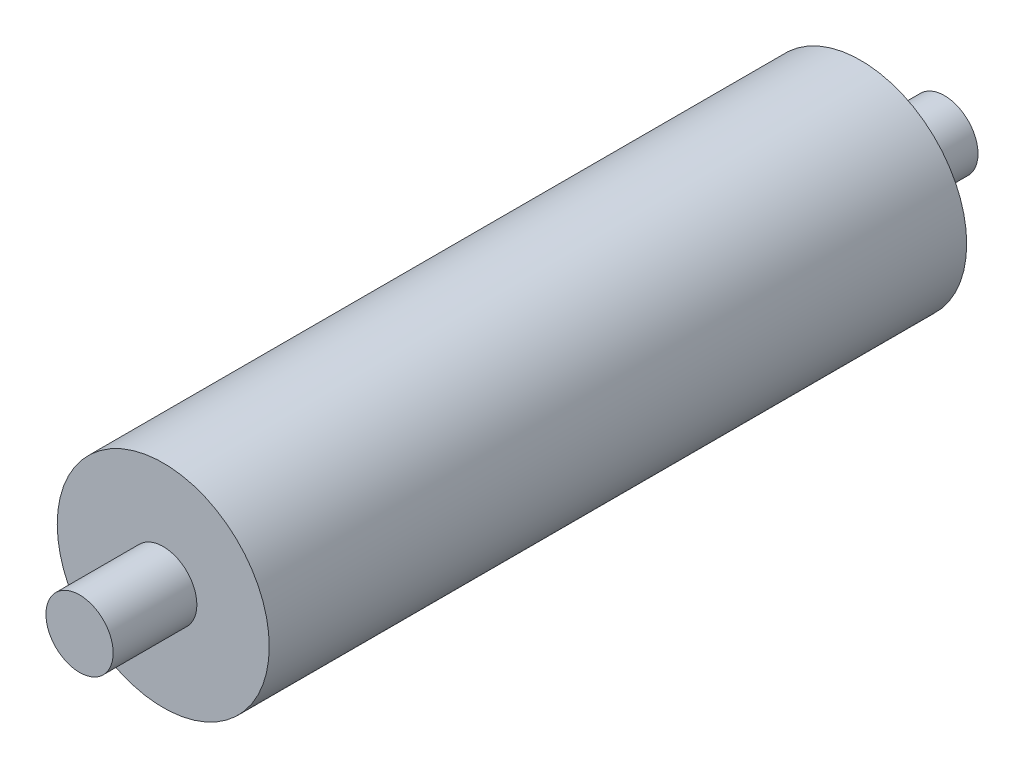
from build123d import *

# Parameters (mm, degrees)
SKETCH1_R                 = 19
SKETCH1_R_2               = 14
BOSS_EXTRUDE1_DEPTH       = 125
BOSS_EXTRUDE2_START       = 7.5
SKETCH2_R                 = 14
BOSS_EXTRUDE2_DEPTH       = 7.5
CUT_EXTRUDE1_DEPTH        = 121.53319045
CUT_EXTRUDE1_DEPTH_BACK   = 121.53319045
SKETCH4_R                 = 6.025
SKETCH5_R                 = 14
BOSS_EXTRUDE3_DEPTH       = 7.5
BOSS_EXTRUDE4_DEPTH       = 15
BOSS_EXTRUDE4_DEPTH_BACK  = 140
SKETCH7_R                 = 6.025
SKETCH8_R                 = 15
BOSS_EXTRUDE5_DEPTH       = 5
LPATTERN2_COUNT           = 2
LPATTERN2_PITCH           = 30
LPATTERN3_COPY_1_SKETCH_R = 15
LPATTERN3_COPY_1_DEPTH    = 5
LPATTERN3_COPY_2_SKETCH_R = 15
LPATTERN3_COPY_2_DEPTH    = 5


with BuildPart() as part:
    # Sketch1 → Boss-Extrude1 (new body)
    with BuildSketch(Plane.XY):
        Circle(SKETCH1_R)
        Circle(SKETCH1_R_2, mode=Mode.SUBTRACT)
    extrude(amount=-BOSS_EXTRUDE1_DEPTH)

    # Sketch2 → Boss-Extrude2 (add)
    with BuildSketch(Plane.XY.offset(-7.5).offset(BOSS_EXTRUDE2_START)):
        Circle(SKETCH2_R)
    extrude(amount=-BOSS_EXTRUDE2_DEPTH)

    # Sketch4 → Cut-Extrude1 (cut, two sides: drawn at the far end of the back side and taken through both)
    with BuildSketch(Plane.XY.offset(-7.5).offset(-CUT_EXTRUDE1_DEPTH_BACK)):
        Circle(SKETCH4_R)
    extrude(amount=CUT_EXTRUDE1_DEPTH + CUT_EXTRUDE1_DEPTH_BACK, mode=Mode.SUBTRACT)

    # Sketch5 → Boss-Extrude3 (add)
    with BuildSketch(Plane(origin=(0, 0, -117.5), x_dir=(-1, 0, 0), z_dir=(0, 0, -1))):
        with Locations(Location((0, 0, 0), (0, 0, 180))):
            Circle(SKETCH5_R)
    extrude(amount=BOSS_EXTRUDE3_DEPTH)

    # Sketch7 → Boss-Extrude4 (add, two sides: drawn at the far end of the back side and taken through both)
    with BuildSketch(Plane.XY.offset(-BOSS_EXTRUDE4_DEPTH_BACK)):
        Circle(SKETCH7_R)
    extrude(amount=BOSS_EXTRUDE4_DEPTH + BOSS_EXTRUDE4_DEPTH_BACK)

    # Sketch8 → Boss-Extrude5 (add, symmetric)
    with BuildSketch(Plane.XY.offset(-62.5)):
        Circle(SKETCH8_R)
    boss_extrude5 = extrude(amount=BOSS_EXTRUDE5_DEPTH, both=True)

    # LPattern2: Boss-Extrude5 ×2
    with Locations(*[(0, 0, -i * LPATTERN2_PITCH) for i in range(1, LPATTERN2_COUNT)]):
        add(boss_extrude5)

    # LPattern3 copy 1 sketch → LPattern3 copy 1 (add, symmetric)
    with BuildSketch(Plane.XY.offset(-62.5)):
        Circle(LPATTERN3_COPY_1_SKETCH_R)
    extrude(amount=LPATTERN3_COPY_1_DEPTH, both=True)

    # LPattern3 copy 2 sketch → LPattern3 copy 2 (add, symmetric)
    with BuildSketch(Plane.XY.offset(-32.5)):
        Circle(LPATTERN3_COPY_2_SKETCH_R)
    extrude(amount=LPATTERN3_COPY_2_DEPTH, both=True)


solid = part.part
